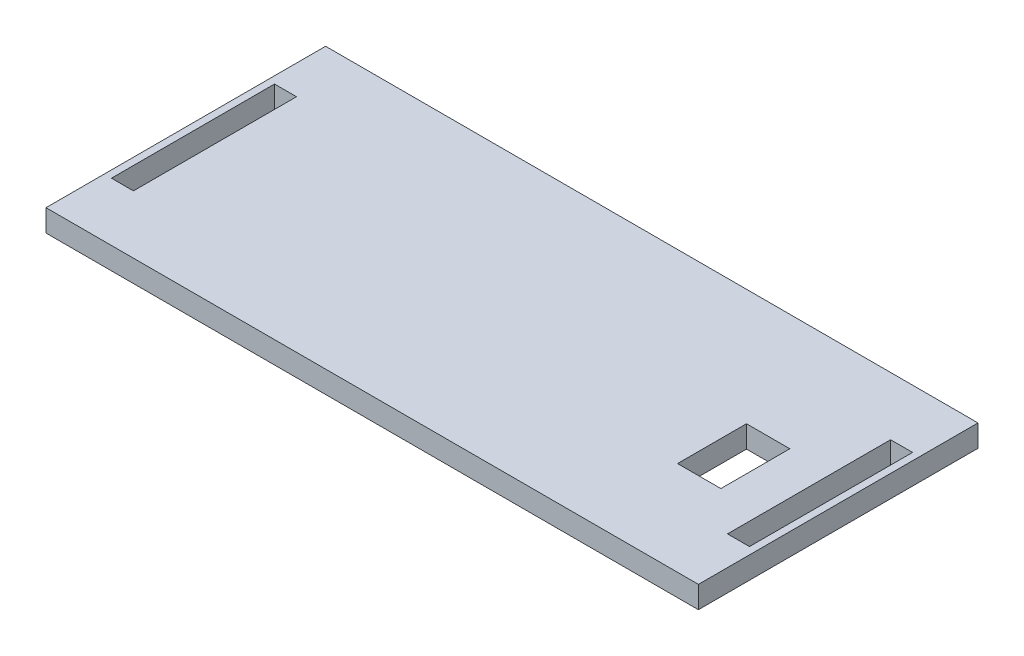
from build123d import *

# Parameters (mm, degrees)
SKETCH1_W           = 177.8
SKETCH1_H           = 76.2
SKETCH1_W_2         = 5.9944
SKETCH1_H_2         = 44.45
SKETCH1_W_3         = 11.811
SKETCH1_H_3         = 18.796
BOSS_EXTRUDE1_DEPTH = 5.9944


with BuildPart() as part:
    # Sketch1 → Boss-Extrude1 (new body)
    with BuildSketch(Plane(origin=(0, 0, 0), x_dir=(1, 0, 0), z_dir=(0, 1, 0))):
        with Locations((88.9, -38.1)):
            Rectangle(SKETCH1_W, SKETCH1_H)
        with Locations((4.952000002, -38.1)):
            Rectangle(SKETCH1_W_2, SKETCH1_H_2, mode=Mode.SUBTRACT)
        with Locations((172.847999998, -38.1)):
            Rectangle(SKETCH1_W_2, SKETCH1_H_2, mode=Mode.SUBTRACT)
        with Locations((152.350199998, -41.1353)):
            Rectangle(SKETCH1_W_3, SKETCH1_H_3, mode=Mode.SUBTRACT)
    extrude(amount=BOSS_EXTRUDE1_DEPTH)


solid = part.part
